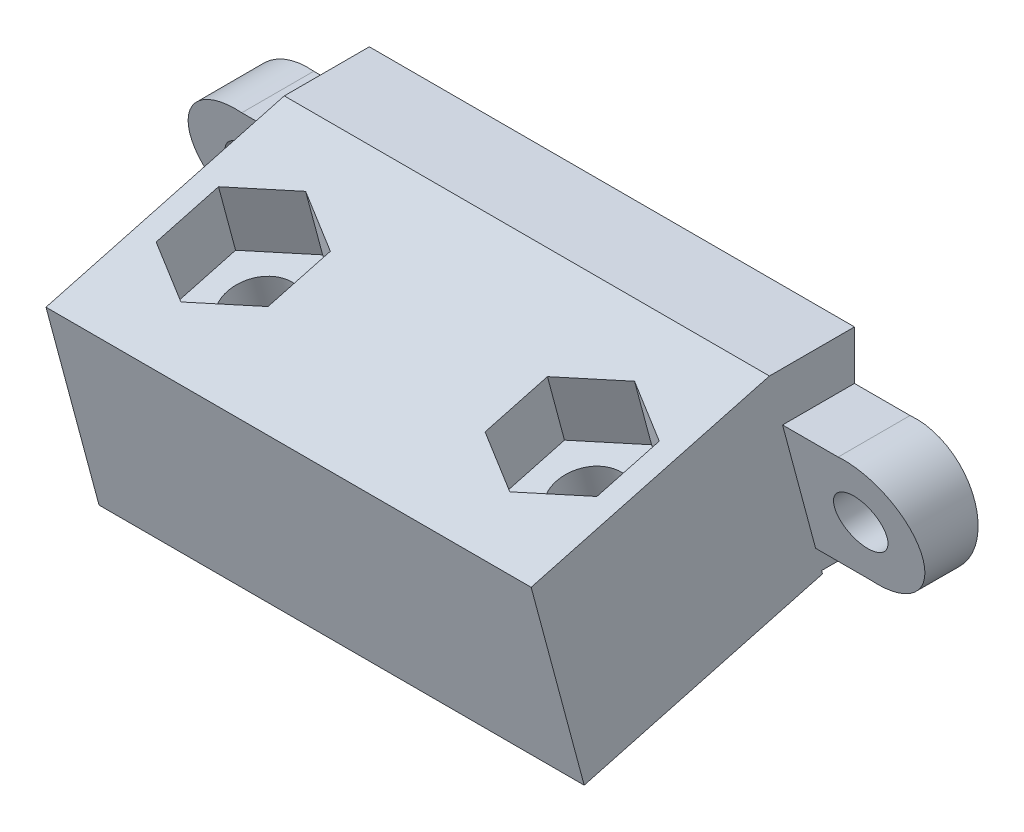
from build123d import *

# Parameters (mm, degrees)
SKETCH1_R           = 1.6
BOSS_EXTRUDE1_DEPTH = 2
SKETCH3_W           = 29.5
SKETCH3_H           = 15
SKETCH3_R           = 2
BOSS_EXTRUDE2_DEPTH = 11.638171
BOSS_EXTRUDE3_REACH = 45.79
SKETCH1_2_R         = 1.6
SKETCH3_2_W         = 29.5
SKETCH3_2_H         = 15
SKETCH3_2_R         = 2
BOSS_EXTRUDE4_DEPTH = 12.458742
CUT_EXTRUDE1_DEPTH  = 4


with BuildPart() as part:
    # Sketch1 → Boss-Extrude1 (new body)
    with BuildSketch(Plane.XY):
        with BuildLine():
            Line((-32.88, 10.023123532), (-29.5, 10.023123532))
            Line((-29.5, 10.023123532), (-29.5, 13))
            Line((-29.5, 13), (0, 13))
            Line((0, 13), (0, 10.023123532))
            Line((0, 10.023123532), (3.38, 10.023123532))
            ThreePointArc((3.38, 10.023123532), (7.518209124, 6.273123532), (3.38, 2.523123532))
            Line((3.38, 2.523123532), (0, 2.523123532))
            Line((0, 2.523123532), (0, 1.167746206))
            Line((0, 1.167746206), (-29.5, 1.167746206))
            Line((-29.5, 1.167746206), (-29.5, 2.523123532))
            Line((-29.5, 2.523123532), (-32.88, 2.523123532))
            ThreePointArc((-32.88, 2.523123532), (-37.018209124, 6.273123532), (-32.88, 10.023123532))
        make_face()
        with Locations((-33.25, 6.273123532)):
            Circle(SKETCH1_R, mode=Mode.SUBTRACT)
        with Locations((3.75, 6.273123532)):
            Circle(SKETCH1_R, mode=Mode.SUBTRACT)
    extrude(amount=BOSS_EXTRUDE1_DEPTH)


with BuildPart() as body_2:
    # Sketch3 → Boss-Extrude2 (new body)
    with BuildSketch(Plane(origin=(0, 1.387555227, 0.371794302), x_dir=(1, 0, 0), z_dir=(0, 0.9659258262890684, 0.2588190451025204))):
        with Locations((-14.75, -9.129616695)):
            Rectangle(SKETCH3_W, SKETCH3_H)
        with Locations(Location((-4.75, -9.129616695, 0), (0, 0, 270))):
            Circle(SKETCH3_R, mode=Mode.SUBTRACT)
        with Locations(Location((-24.75, -9.129616695, 0), (0, 0, 270))):
            Circle(SKETCH3_R, mode=Mode.SUBTRACT)
    extrude(amount=BOSS_EXTRUDE2_DEPTH)

    # Boss-Extrude3: up to this face of the body (flat: up to its plane)
    boss_extrude3_end = Plane(body_2.part.faces().sort_by_distance((-14.75, 6.58658436, 3.451973307))[0])
    # Sketch1<2> → Boss-Extrude3 (add, up to the picked face)
    with BuildSketch(Plane.XY, mode=Mode.PRIVATE) as boss_extrude3_sk1:
        with BuildLine():
            Line((-32.88, 10.023123532), (-29.5, 10.023123532))
            Line((-29.5, 10.023123532), (-29.5, 13))
            Line((-29.5, 13), (0, 13))
            Line((0, 13), (0, 10.023123532))
            Line((0, 10.023123532), (3.38, 10.023123532))
            ThreePointArc((3.38, 10.023123532), (7.518209124, 6.273123532), (3.38, 2.523123532))
            Line((3.38, 2.523123532), (0, 2.523123532))
            Line((0, 2.523123532), (0, 1.167746206))
            Line((0, 1.167746206), (-29.5, 1.167746206))
            Line((-29.5, 1.167746206), (-29.5, 2.523123532))
            Line((-29.5, 2.523123532), (-32.88, 2.523123532))
            ThreePointArc((-32.88, 2.523123532), (-37.018209124, 6.273123532), (-32.88, 10.023123532))
        make_face()
        with Locations(Location((-33.25, 6.273123532, 0), (0, 0, 270))):
            Circle(SKETCH1_2_R, mode=Mode.SUBTRACT)
        with Locations(Location((3.75, 6.273123532, 0), (0, 0, 270))):
            Circle(SKETCH1_2_R, mode=Mode.SUBTRACT)
    boss_extrude3_tool1 = split(extrude(boss_extrude3_sk1.sketch, amount=BOSS_EXTRUDE3_REACH, mode=Mode.PRIVATE), bisect_by=boss_extrude3_end, keep=Keep.BOTH, mode=Mode.PRIVATE)

    add(part.part)  # Boss-Extrude3 merges part
    add(boss_extrude3_tool1.solids().sort_by(Axis((-14.75, 6.925418, 0), (0, 0, 1)))[0])

    # Sketch3<2> → Boss-Extrude4 (add)
    with BuildSketch(Plane(origin=(0, 1.387555227, 0.371794302), x_dir=(1, 0, 0), z_dir=(0, 0.9659258262890684, 0.2588190451025204))):
        with Locations((-14.75, -9.129616695)):
            Rectangle(SKETCH3_2_W, SKETCH3_2_H)
        with Locations(Location((-4.75, -9.129616695, 0), (0, 0, 270))):
            Circle(SKETCH3_2_R, mode=Mode.SUBTRACT)
        with Locations(Location((-24.75, -9.129616695, 0), (0, 0, 270))):
            Circle(SKETCH3_2_R, mode=Mode.SUBTRACT)
    extrude(amount=BOSS_EXTRUDE4_DEPTH)

    # Sketch4 → Cut-Extrude1 (cut)
    with BuildSketch(Plane(origin=(0, 13.421775837, 3.596353996), x_dir=(1, 0, 0), z_dir=(0, 0.9659258262890684, 0.2588190451025205))):
        Polygon((-1.35, -11.09260761), (-1.35, -7.166625779), (-4.75, -5.203634864), (-8.15, -7.166625779), (-8.15, -11.09260761), (-4.75, -13.055598525), align=None)
        Polygon((-21.35, -7.166625779), (-24.75, -5.203634864), (-28.15, -7.166625779), (-28.15, -11.09260761), (-24.75, -13.055598525), (-21.35, -11.09260761), align=None)
    extrude(amount=-CUT_EXTRUDE1_DEPTH, mode=Mode.SUBTRACT)


solid = body_2.part
